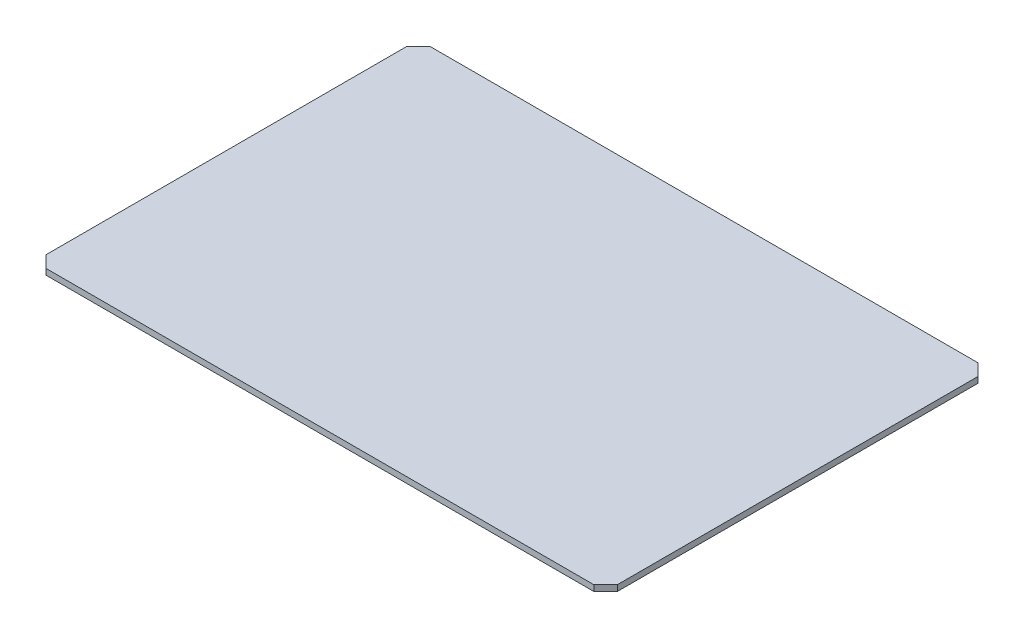
from build123d import *

# Parameters (mm, degrees)
SKETCH1_W           = 290
SKETCH1_H           = 195
BOSS_EXTRUDE1_DEPTH = 3
CHAMFER1_SIZE       = 6


with BuildPart() as part:
    # Sketch1 → Boss-Extrude1 (new body)
    with BuildSketch(Plane(origin=(0, 0, 0), x_dir=(1, 0, 0), z_dir=(0, 1, 0))):
        with Locations((145, 97.5)):
            Rectangle(SKETCH1_W, SKETCH1_H)
    extrude(amount=BOSS_EXTRUDE1_DEPTH)

    # Chamfer1
    chamfer1_edges = [part.edges().sort_by_distance(p)[0] for p in [
        (0, 1.5, -195),
        (290, 1.5, -195),
        (290, 1.5, 0),
        (0, 1.5, 0),
    ]]
    chamfer(chamfer1_edges, length=CHAMFER1_SIZE)


solid = part.part
